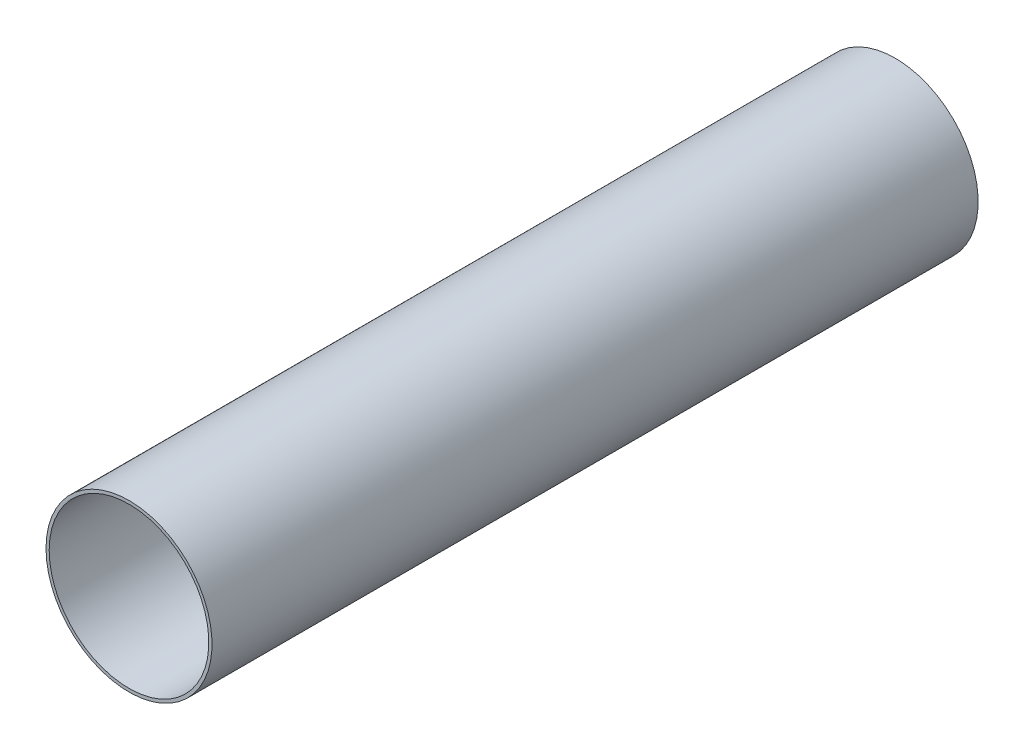
from build123d import *

# Parameters (mm, degrees)
SKETCH2_R           = 13
SKETCH2_R_2         = 12.5
BOSS_EXTRUDE1_DEPTH = 60


with BuildPart() as part:
    # Sketch2 → Boss-Extrude1 (new, symmetric)
    with BuildSketch(Plane.XY):
        with Locations(Location((0, 0, 0), (0, 0, 180))):
            Circle(SKETCH2_R)
        with Locations(Location((0, 0, 0), (0, 0, 180))):
            Circle(SKETCH2_R_2, mode=Mode.SUBTRACT)
    extrude(amount=BOSS_EXTRUDE1_DEPTH, both=True)


solid = part.part
